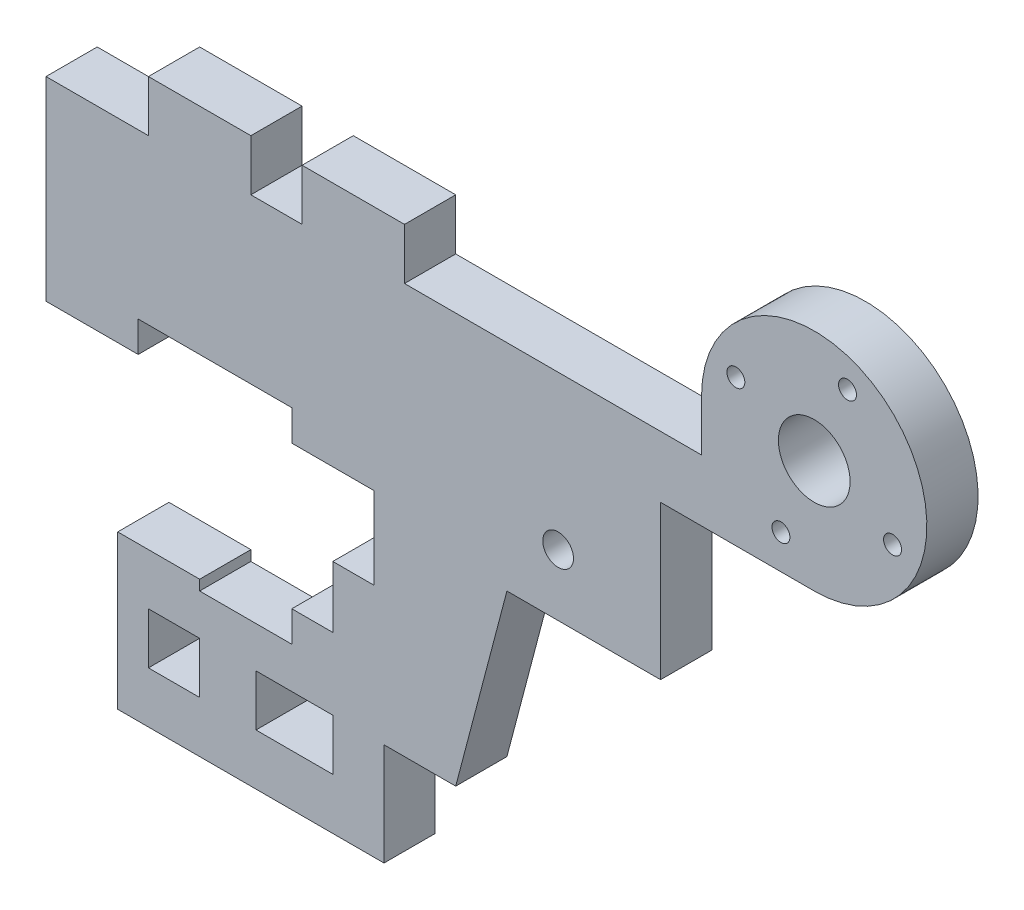
from build123d import *

# Parameters (mm, degrees)
ESQUISSE1_W        = 5
ESQUISSE1_H        = 5
ESQUISSE1_W_2      = 7.5
ESQUISSE1_R        = 1.5
ESQUISSE1_R_2      = 0.875
ESQUISSE1_R_3      = 3.5
BOSS_EXTRU_1_DEPTH = 5


with BuildPart() as part:
    # Esquisse1 → Boss.-Extru.1 (new body)
    with BuildSketch(Plane.XY):
        with BuildLine():
            Line((-8, 5), (-8, -10))
            Line((-8, -10), (18, -10))
            Line((18, -10), (18, 0))
            Line((18, 0), (25, 0))
            Line((25, 0), (30, 19))
            Line((30, 19), (45, 19))
            Line((45, 19), (45, 34))
            Line((45, 34), (60, 34))
            ThreePointArc((60, 34), (67.778174593, 52.778174593), (49, 45))
            Line((49, 45), (49, 40))
            Line((49, 40), (20, 40))
            Line((20, 40), (20, 45))
            Line((20, 45), (10, 45))
            Line((10, 45), (10, 40))
            Line((10, 40), (5, 40))
            Line((5, 40), (5, 45))
            Line((5, 45), (-5, 45))
            Line((-5, 45), (-5, 40))
            Line((-5, 40), (-15, 40))
            Line((-15, 40), (-15, 21))
            Line((-15, 21), (-6, 21))
            Line((-6, 21), (-6, 24))
            Line((-6, 24), (9, 24))
            Line((9, 24), (9, 21))
            Line((9, 21), (17, 21))
            Line((17, 21), (17, 13))
            Line((17, 13), (13, 13))
            Line((13, 13), (13, 7))
            Line((13, 7), (9, 7))
            Line((9, 7), (9, 4))
            Line((9, 4), (0, 4))
            Line((0, 4), (0, 5))
            Line((0, 5), (-8, 5))
        make_face()
        with Locations((-2.5, -2.5)):
            Rectangle(ESQUISSE1_W, ESQUISSE1_H, mode=Mode.SUBTRACT)
        with Locations((9.25, -2.5)):
            Rectangle(ESQUISSE1_W_2, ESQUISSE1_H, mode=Mode.SUBTRACT)
        with Locations((35, 25)):
            Circle(ESQUISSE1_R, mode=Mode.SUBTRACT)
        with Locations((56.75, 37.35)):
            Circle(ESQUISSE1_R_2, mode=Mode.SUBTRACT)
        with Locations((60, 45)):
            Circle(ESQUISSE1_R_3, mode=Mode.SUBTRACT)
        with Locations((67.65, 41.75)):
            Circle(ESQUISSE1_R_2, mode=Mode.SUBTRACT)
        with Locations((52.35, 48.25)):
            Circle(ESQUISSE1_R_2, mode=Mode.SUBTRACT)
        with Locations((63.25, 52.65)):
            Circle(ESQUISSE1_R_2, mode=Mode.SUBTRACT)
    extrude(amount=BOSS_EXTRU_1_DEPTH)


solid = part.part
